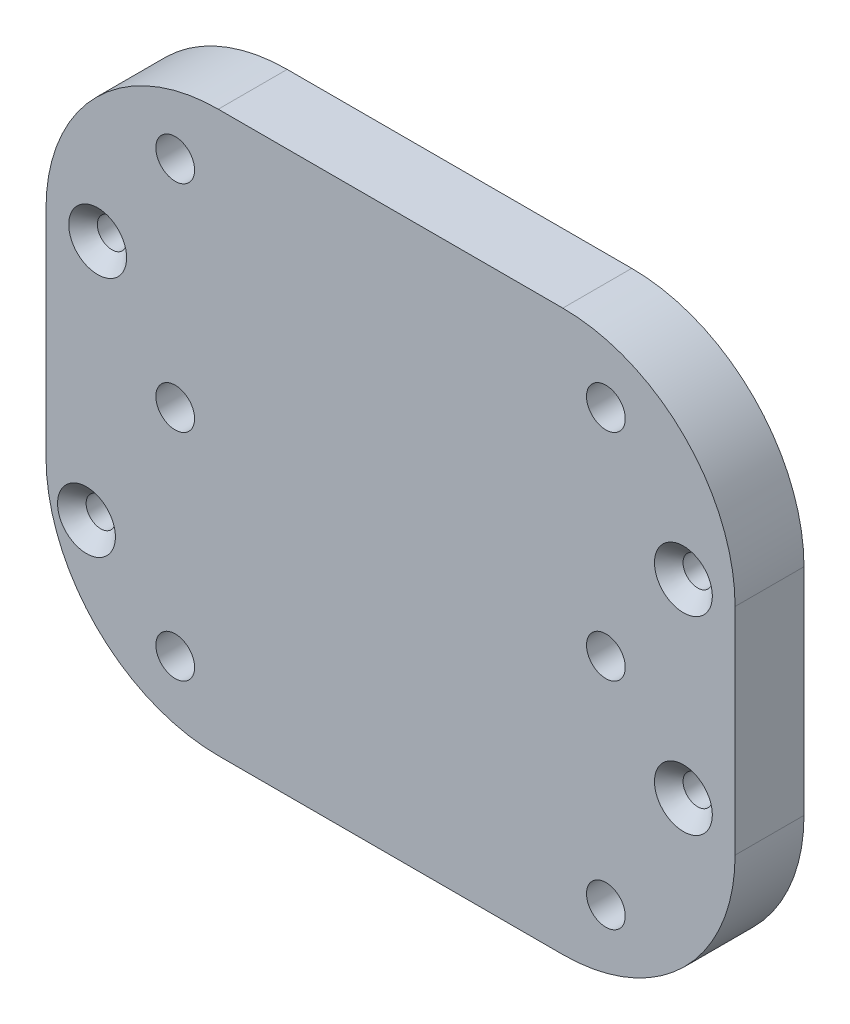
from build123d import *

# Parameters (mm, degrees)
SKETCH1_W                                            = 85
SKETCH1_H                                            = 65
BOSS_EXTRUDE1_DEPTH                                  = 8
CSK_FOR_M4_HEX_SOCKET_COUNTERSUNK_CAP_SC_D           = 4.5
CSK_FOR_M4_HEX_SOCKET_COUNTERSUNK_CAP_SC_DEPTH       = 10.648063607
CSK_FOR_M4_HEX_SOCKET_COUNTERSUNK_CAP_SC_CSINK_D     = 8.96
CSK_FOR_M4_HEX_SOCKET_COUNTERSUNK_CAP_SC_CSINK_ANGLE = 90
CSK_FOR_M4_HEX_SOCKET_COUNTERSUNK_CAP_SC_TIP         = 1.351936393
CSK_FOR_M3_HEX_SOCKET_COUNTERSUNK_CAP_SC_D           = 3.4
CSK_FOR_M3_HEX_SOCKET_COUNTERSUNK_CAP_SC_DEPTH       = 10.978536948
CSK_FOR_M3_HEX_SOCKET_COUNTERSUNK_CAP_SC_CSINK_D     = 6.72
CSK_FOR_M3_HEX_SOCKET_COUNTERSUNK_CAP_SC_CSINK_ANGLE = 90
CSK_FOR_M3_HEX_SOCKET_COUNTERSUNK_CAP_SC_TIP         = 1.021463052
SKETCH11_W                                           = 5
SKETCH11_H                                           = 65
CUT_EXTRUDE1_DEPTH                                   = 108.30330843
FILLET1_R                                            = 20


with BuildPart() as part:
    # Sketch1 → Boss-Extrude1 (new body)
    with BuildSketch(Plane.XY):
        with Locations((42.5, 32.5)):
            Rectangle(SKETCH1_W, SKETCH1_H)
    extrude(amount=BOSS_EXTRUDE1_DEPTH)

    # CSK for M4 Hex Socket Countersunk Cap Screw1
    with Locations(Plane(origin=(0, 0, 0), x_dir=(-1, 0, 0), z_dir=(0, 0, -1))):
        with Locations((-70, 57.5), (-20, 57.5), (-20, 32.5), (-70, 32.5), (-70, 7.5), (-20, 7.5)):
            CounterSinkHole(CSK_FOR_M4_HEX_SOCKET_COUNTERSUNK_CAP_SC_D / 2, CSK_FOR_M4_HEX_SOCKET_COUNTERSUNK_CAP_SC_CSINK_D / 2, depth=CSK_FOR_M4_HEX_SOCKET_COUNTERSUNK_CAP_SC_DEPTH, counter_sink_angle=CSK_FOR_M4_HEX_SOCKET_COUNTERSUNK_CAP_SC_CSINK_ANGLE)
            with Locations((0, 0, -(CSK_FOR_M4_HEX_SOCKET_COUNTERSUNK_CAP_SC_DEPTH + CSK_FOR_M4_HEX_SOCKET_COUNTERSUNK_CAP_SC_TIP / 2))):  # 118° drill point
                Cone(0, CSK_FOR_M4_HEX_SOCKET_COUNTERSUNK_CAP_SC_D / 2, CSK_FOR_M4_HEX_SOCKET_COUNTERSUNK_CAP_SC_TIP, mode=Mode.SUBTRACT)

    # CSK for M3 Hex Socket Countersunk Cap Screw1
    with Locations(Plane.XY.offset(8)):
        with Locations((11, 44.728312208), (79, 44.728312208), (79, 22.728312208), (9.7, 16.028312208)):
            CounterSinkHole(CSK_FOR_M3_HEX_SOCKET_COUNTERSUNK_CAP_SC_D / 2, CSK_FOR_M3_HEX_SOCKET_COUNTERSUNK_CAP_SC_CSINK_D / 2, depth=CSK_FOR_M3_HEX_SOCKET_COUNTERSUNK_CAP_SC_DEPTH, counter_sink_angle=CSK_FOR_M3_HEX_SOCKET_COUNTERSUNK_CAP_SC_CSINK_ANGLE)
            with Locations((0, 0, -(CSK_FOR_M3_HEX_SOCKET_COUNTERSUNK_CAP_SC_DEPTH + CSK_FOR_M3_HEX_SOCKET_COUNTERSUNK_CAP_SC_TIP / 2))):  # 118° drill point
                Cone(0, CSK_FOR_M3_HEX_SOCKET_COUNTERSUNK_CAP_SC_D / 2, CSK_FOR_M3_HEX_SOCKET_COUNTERSUNK_CAP_SC_TIP, mode=Mode.SUBTRACT)

    # Sketch11 → Cut-Extrude1 (cut, through all)
    with BuildSketch(Plane.XY.offset(8)):
        with Locations((2.5, 32.5)):
            Rectangle(SKETCH11_W, SKETCH11_H)
    extrude(amount=-CUT_EXTRUDE1_DEPTH, mode=Mode.SUBTRACT)

    # Fillet1
    fillet1_edges = [part.edges().sort_by_distance(p)[0] for p in [
        (85, 65, 4),
        (85, 0, 4),
        (5, 65, 4),
        (5, 0, 4),
    ]]
    fillet(fillet1_edges, radius=FILLET1_R)


solid = part.part
